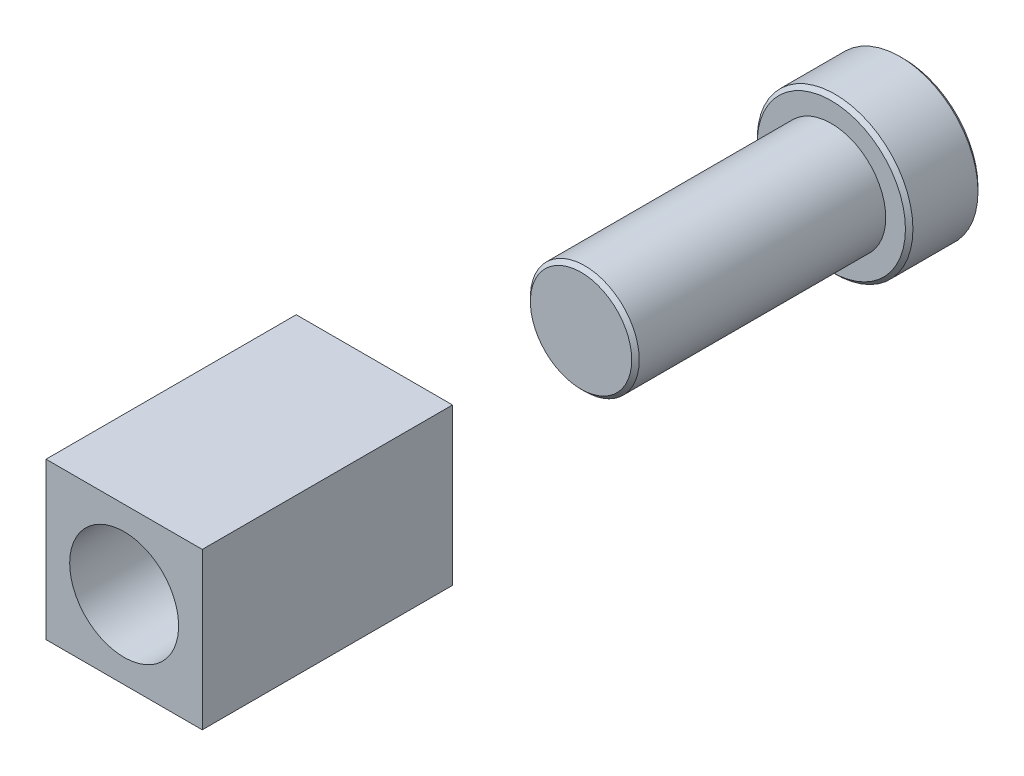
from build123d import *

# Parameters (mm, degrees)
SKETCH1_R           = 15.8115
BOSS_EXTRUDE1_DEPTH = 14.732
SKETCH2_R           = 11.049
BOSS_EXTRUDE2_DEPTH = 50.8
SKETCH3_W           = 31.722698392
SKETCH3_H           = 31.722698392
BOSS_EXTRUDE3_DEPTH = 50.8
SKETCH4_R           = 11.05535
CUT_EXTRUDE1_DEPTH  = 110.798996017
CHAMFER1_SIZE       = 0.762


with BuildPart() as part:
    # Sketch1 → Boss-Extrude1 (new body)
    with BuildSketch(Plane.XY):
        Circle(SKETCH1_R)
    extrude(amount=BOSS_EXTRUDE1_DEPTH)

    # Sketch2 → Boss-Extrude2 (add)
    with BuildSketch(Plane.XY.offset(14.732)):
        Circle(SKETCH2_R)
    extrude(amount=BOSS_EXTRUDE2_DEPTH)

    # Chamfer1
    chamfer1_edges = [part.edges().sort_by_distance(p)[0] for p in [
        (-15.8115, 0, 0),
        (-15.8115, 0, 14.732),
        (-11.049, 0, 65.532),
    ]]
    chamfer(chamfer1_edges, length=CHAMFER1_SIZE)


with BuildPart() as body_2:
    # Sketch3 → Boss-Extrude3 (new body)
    with BuildSketch(Plane.XY.offset(107.483276511)):
        Rectangle(SKETCH3_W, SKETCH3_H)
    extrude(amount=BOSS_EXTRUDE3_DEPTH)

    # Sketch4 → Cut-Extrude1 (cut, through all)
    with BuildSketch(Plane(origin=(0, 0, 107.483276511), x_dir=(-1, 0, 0), z_dir=(0, 0, -1))):
        Circle(SKETCH4_R)
    extrude(amount=-CUT_EXTRUDE1_DEPTH, mode=Mode.SUBTRACT)


solid = Compound([part.part, body_2.part])
